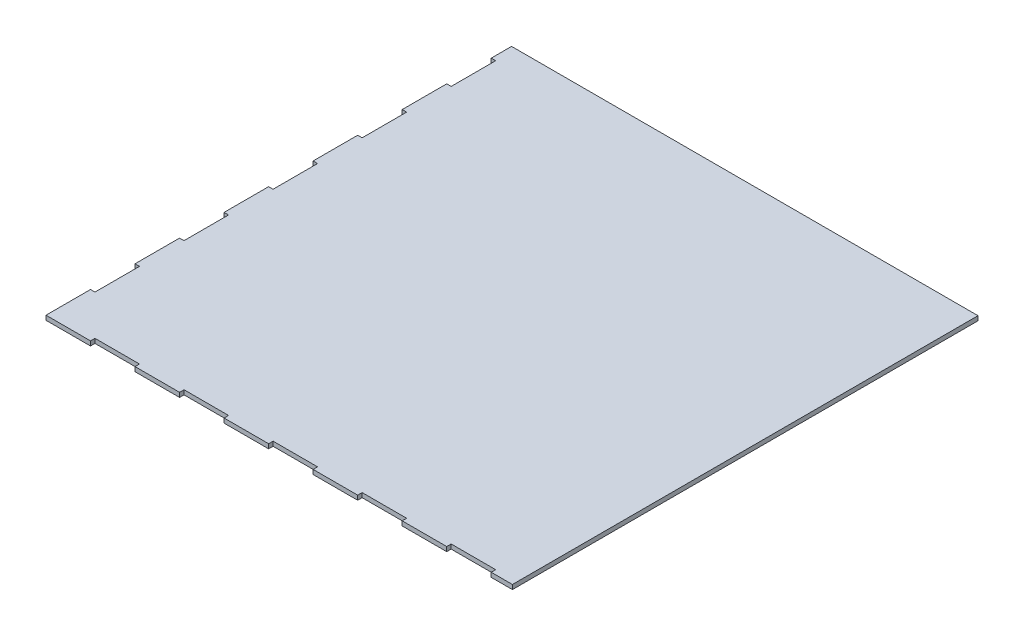
from build123d import *

# Parameters (mm, degrees)
SKETCH1_W               = 630
SKETCH1_H               = 630
BOSS_EXTRUDE1_DEPTH     = 3
SKETCH3_W               = 3
SKETCH3_H               = 30
CUT_EXTRUDE2_DEPTH      = 3
LPATTERN2_COUNT         = 10
LPATTERN2_PITCH         = 60
MIRROR1_COPY_1_SKETCH_W = 3
MIRROR1_COPY_1_SKETCH_H = 30
MIRROR1_COPY_1_DEPTH    = 3
MIRROR1_COPY_2_SKETCH_W = 3
MIRROR1_COPY_2_SKETCH_H = 30
MIRROR1_COPY_2_DEPTH    = 3
MIRROR1_COPY_3_SKETCH_W = 3
MIRROR1_COPY_3_SKETCH_H = 30
MIRROR1_COPY_3_DEPTH    = 3
MIRROR1_COPY_4_SKETCH_W = 3
MIRROR1_COPY_4_SKETCH_H = 30
MIRROR1_COPY_4_DEPTH    = 3
MIRROR1_COPY_5_SKETCH_W = 3
MIRROR1_COPY_5_SKETCH_H = 30
MIRROR1_COPY_5_DEPTH    = 3
MIRROR1_COPY_6_SKETCH_W = 3
MIRROR1_COPY_6_SKETCH_H = 30
MIRROR1_COPY_6_DEPTH    = 3
MIRROR1_COPY_7_SKETCH_W = 3
MIRROR1_COPY_7_SKETCH_H = 30
MIRROR1_COPY_7_DEPTH    = 3
MIRROR1_COPY_8_SKETCH_W = 3
MIRROR1_COPY_8_SKETCH_H = 30
MIRROR1_COPY_8_DEPTH    = 3
MIRROR1_COPY_9_SKETCH_W = 3
MIRROR1_COPY_9_SKETCH_H = 30
MIRROR1_COPY_9_DEPTH    = 3
SKETCH5_W               = 30
SKETCH5_H               = 3
CUT_EXTRUDE3_DEPTH      = 3
LPATTERN3_COUNT         = 10
LPATTERN3_PITCH         = 60
MIRROR2_COPY_1_SKETCH_W = 30
MIRROR2_COPY_1_SKETCH_H = 3
MIRROR2_COPY_1_DEPTH    = 3
MIRROR2_COPY_2_SKETCH_W = 30
MIRROR2_COPY_2_SKETCH_H = 3
MIRROR2_COPY_2_DEPTH    = 3
MIRROR2_COPY_3_SKETCH_W = 30
MIRROR2_COPY_3_SKETCH_H = 3
MIRROR2_COPY_3_DEPTH    = 3
MIRROR2_COPY_4_SKETCH_W = 30
MIRROR2_COPY_4_SKETCH_H = 3
MIRROR2_COPY_4_DEPTH    = 3
MIRROR2_COPY_5_SKETCH_W = 30
MIRROR2_COPY_5_SKETCH_H = 3
MIRROR2_COPY_5_DEPTH    = 3
MIRROR2_COPY_6_SKETCH_W = 30
MIRROR2_COPY_6_SKETCH_H = 3
MIRROR2_COPY_6_DEPTH    = 3
MIRROR2_COPY_7_SKETCH_W = 30
MIRROR2_COPY_7_SKETCH_H = 3
MIRROR2_COPY_7_DEPTH    = 3
MIRROR2_COPY_8_SKETCH_W = 30
MIRROR2_COPY_8_SKETCH_H = 3
MIRROR2_COPY_8_DEPTH    = 3
MIRROR2_COPY_9_SKETCH_W = 30
MIRROR2_COPY_9_SKETCH_H = 3
MIRROR2_COPY_9_DEPTH    = 3


with BuildPart() as part:
    # Sketch1 → Boss-Extrude1 (new body)
    with BuildSketch(Plane(origin=(0, 0, 0), x_dir=(1, 0, 0), z_dir=(0, 1, 0))):
        Rectangle(SKETCH1_W, SKETCH1_H)
    extrude(amount=BOSS_EXTRUDE1_DEPTH)

    # Sketch3 → Cut-Extrude2 (cut)
    with BuildSketch(Plane(origin=(0, 3, 0), x_dir=(1, 0, 0), z_dir=(0, 1, 0))):
        with Locations((-313.5, -270.006843512)):
            Rectangle(SKETCH3_W, SKETCH3_H)
    cut_extrude2 = extrude(amount=-CUT_EXTRUDE2_DEPTH, mode=Mode.SUBTRACT)

    # LPattern2: Cut-Extrude2 ×10
    with Locations(*[(0, 0, -i * LPATTERN2_PITCH) for i in range(1, LPATTERN2_COUNT)]):
        add(cut_extrude2, mode=Mode.SUBTRACT)

    # Mirror1: Cut-Extrude2 across plane
    add(cut_extrude2.mirror(Plane(origin=(-0.725, 0, 0), x_dir=(0, 0, 1), z_dir=(1, 0, 0))), mode=Mode.SUBTRACT)

    # Mirror1 copy 1 sketch → Mirror1 copy 1 (cut)
    with BuildSketch(Plane(origin=(-1.45, 3, -60), x_dir=(-1, 0, 0), z_dir=(0, 1, 0))):
        with Locations((-313.5, 270.006843512)):
            Rectangle(MIRROR1_COPY_1_SKETCH_W, MIRROR1_COPY_1_SKETCH_H)
    extrude(amount=-MIRROR1_COPY_1_DEPTH, mode=Mode.SUBTRACT)

    # Mirror1 copy 2 sketch → Mirror1 copy 2 (cut)
    with BuildSketch(Plane(origin=(-1.45, 3, -120), x_dir=(-1, 0, 0), z_dir=(0, 1, 0))):
        with Locations((-313.5, 270.006843512)):
            Rectangle(MIRROR1_COPY_2_SKETCH_W, MIRROR1_COPY_2_SKETCH_H)
    extrude(amount=-MIRROR1_COPY_2_DEPTH, mode=Mode.SUBTRACT)

    # Mirror1 copy 3 sketch → Mirror1 copy 3 (cut)
    with BuildSketch(Plane(origin=(-1.45, 3, -180), x_dir=(-1, 0, 0), z_dir=(0, 1, 0))):
        with Locations((-313.5, 270.006843512)):
            Rectangle(MIRROR1_COPY_3_SKETCH_W, MIRROR1_COPY_3_SKETCH_H)
    extrude(amount=-MIRROR1_COPY_3_DEPTH, mode=Mode.SUBTRACT)

    # Mirror1 copy 4 sketch → Mirror1 copy 4 (cut)
    with BuildSketch(Plane(origin=(-1.45, 3, -240), x_dir=(-1, 0, 0), z_dir=(0, 1, 0))):
        with Locations((-313.5, 270.006843512)):
            Rectangle(MIRROR1_COPY_4_SKETCH_W, MIRROR1_COPY_4_SKETCH_H)
    extrude(amount=-MIRROR1_COPY_4_DEPTH, mode=Mode.SUBTRACT)

    # Mirror1 copy 5 sketch → Mirror1 copy 5 (cut)
    with BuildSketch(Plane(origin=(-1.45, 3, -300), x_dir=(-1, 0, 0), z_dir=(0, 1, 0))):
        with Locations((-313.5, 270.006843512)):
            Rectangle(MIRROR1_COPY_5_SKETCH_W, MIRROR1_COPY_5_SKETCH_H)
    extrude(amount=-MIRROR1_COPY_5_DEPTH, mode=Mode.SUBTRACT)

    # Mirror1 copy 6 sketch → Mirror1 copy 6 (cut)
    with BuildSketch(Plane(origin=(-1.45, 3, -360), x_dir=(-1, 0, 0), z_dir=(0, 1, 0))):
        with Locations((-313.5, 270.006843512)):
            Rectangle(MIRROR1_COPY_6_SKETCH_W, MIRROR1_COPY_6_SKETCH_H)
    extrude(amount=-MIRROR1_COPY_6_DEPTH, mode=Mode.SUBTRACT)

    # Mirror1 copy 7 sketch → Mirror1 copy 7 (cut)
    with BuildSketch(Plane(origin=(-1.45, 3, -420), x_dir=(-1, 0, 0), z_dir=(0, 1, 0))):
        with Locations((-313.5, 270.006843512)):
            Rectangle(MIRROR1_COPY_7_SKETCH_W, MIRROR1_COPY_7_SKETCH_H)
    extrude(amount=-MIRROR1_COPY_7_DEPTH, mode=Mode.SUBTRACT)

    # Mirror1 copy 8 sketch → Mirror1 copy 8 (cut)
    with BuildSketch(Plane(origin=(-1.45, 3, -480), x_dir=(-1, 0, 0), z_dir=(0, 1, 0))):
        with Locations((-313.5, 270.006843512)):
            Rectangle(MIRROR1_COPY_8_SKETCH_W, MIRROR1_COPY_8_SKETCH_H)
    extrude(amount=-MIRROR1_COPY_8_DEPTH, mode=Mode.SUBTRACT)

    # Mirror1 copy 9 sketch → Mirror1 copy 9 (cut)
    with BuildSketch(Plane(origin=(-1.45, 3, -540), x_dir=(-1, 0, 0), z_dir=(0, 1, 0))):
        with Locations((-313.5, 270.006843512)):
            Rectangle(MIRROR1_COPY_9_SKETCH_W, MIRROR1_COPY_9_SKETCH_H)
    extrude(amount=-MIRROR1_COPY_9_DEPTH, mode=Mode.SUBTRACT)

    # Sketch5 → Cut-Extrude3 (cut)
    with BuildSketch(Plane(origin=(0, 3, 0), x_dir=(1, 0, 0), z_dir=(0, 1, 0))):
        with Locations((-270.000314512, -313.5)):
            Rectangle(SKETCH5_W, SKETCH5_H)
    cut_extrude3 = extrude(amount=-CUT_EXTRUDE3_DEPTH, mode=Mode.SUBTRACT)

    # LPattern3: Cut-Extrude3 ×10
    with Locations(*[(i * LPATTERN3_PITCH, 0, 0) for i in range(1, LPATTERN3_COUNT)]):
        add(cut_extrude3, mode=Mode.SUBTRACT)

    # Mirror2: Cut-Extrude3 across plane
    add(cut_extrude3.mirror(Plane.XY.offset(1.295)), mode=Mode.SUBTRACT)

    # Mirror2 copy 1 sketch → Mirror2 copy 1 (cut)
    with BuildSketch(Plane(origin=(60, 3, 2.59), x_dir=(1, 0, 0), z_dir=(0, 1, 0))):
        with Locations((-270.000314512, 313.5)):
            Rectangle(MIRROR2_COPY_1_SKETCH_W, MIRROR2_COPY_1_SKETCH_H)
    extrude(amount=-MIRROR2_COPY_1_DEPTH, mode=Mode.SUBTRACT)

    # Mirror2 copy 2 sketch → Mirror2 copy 2 (cut)
    with BuildSketch(Plane(origin=(120, 3, 2.59), x_dir=(1, 0, 0), z_dir=(0, 1, 0))):
        with Locations((-270.000314512, 313.5)):
            Rectangle(MIRROR2_COPY_2_SKETCH_W, MIRROR2_COPY_2_SKETCH_H)
    extrude(amount=-MIRROR2_COPY_2_DEPTH, mode=Mode.SUBTRACT)

    # Mirror2 copy 3 sketch → Mirror2 copy 3 (cut)
    with BuildSketch(Plane(origin=(180, 3, 2.59), x_dir=(1, 0, 0), z_dir=(0, 1, 0))):
        with Locations((-270.000314512, 313.5)):
            Rectangle(MIRROR2_COPY_3_SKETCH_W, MIRROR2_COPY_3_SKETCH_H)
    extrude(amount=-MIRROR2_COPY_3_DEPTH, mode=Mode.SUBTRACT)

    # Mirror2 copy 4 sketch → Mirror2 copy 4 (cut)
    with BuildSketch(Plane(origin=(240, 3, 2.59), x_dir=(1, 0, 0), z_dir=(0, 1, 0))):
        with Locations((-270.000314512, 313.5)):
            Rectangle(MIRROR2_COPY_4_SKETCH_W, MIRROR2_COPY_4_SKETCH_H)
    extrude(amount=-MIRROR2_COPY_4_DEPTH, mode=Mode.SUBTRACT)

    # Mirror2 copy 5 sketch → Mirror2 copy 5 (cut)
    with BuildSketch(Plane(origin=(300, 3, 2.59), x_dir=(1, 0, 0), z_dir=(0, 1, 0))):
        with Locations((-270.000314512, 313.5)):
            Rectangle(MIRROR2_COPY_5_SKETCH_W, MIRROR2_COPY_5_SKETCH_H)
    extrude(amount=-MIRROR2_COPY_5_DEPTH, mode=Mode.SUBTRACT)

    # Mirror2 copy 6 sketch → Mirror2 copy 6 (cut)
    with BuildSketch(Plane(origin=(360, 3, 2.59), x_dir=(1, 0, 0), z_dir=(0, 1, 0))):
        with Locations((-270.000314512, 313.5)):
            Rectangle(MIRROR2_COPY_6_SKETCH_W, MIRROR2_COPY_6_SKETCH_H)
    extrude(amount=-MIRROR2_COPY_6_DEPTH, mode=Mode.SUBTRACT)

    # Mirror2 copy 7 sketch → Mirror2 copy 7 (cut)
    with BuildSketch(Plane(origin=(420, 3, 2.59), x_dir=(1, 0, 0), z_dir=(0, 1, 0))):
        with Locations((-270.000314512, 313.5)):
            Rectangle(MIRROR2_COPY_7_SKETCH_W, MIRROR2_COPY_7_SKETCH_H)
    extrude(amount=-MIRROR2_COPY_7_DEPTH, mode=Mode.SUBTRACT)

    # Mirror2 copy 8 sketch → Mirror2 copy 8 (cut)
    with BuildSketch(Plane(origin=(480, 3, 2.59), x_dir=(1, 0, 0), z_dir=(0, 1, 0))):
        with Locations((-270.000314512, 313.5)):
            Rectangle(MIRROR2_COPY_8_SKETCH_W, MIRROR2_COPY_8_SKETCH_H)
    extrude(amount=-MIRROR2_COPY_8_DEPTH, mode=Mode.SUBTRACT)

    # Mirror2 copy 9 sketch → Mirror2 copy 9 (cut)
    with BuildSketch(Plane(origin=(540, 3, 2.59), x_dir=(1, 0, 0), z_dir=(0, 1, 0))):
        with Locations((-270.000314512, 313.5)):
            Rectangle(MIRROR2_COPY_9_SKETCH_W, MIRROR2_COPY_9_SKETCH_H)
    extrude(amount=-MIRROR2_COPY_9_DEPTH, mode=Mode.SUBTRACT)

    # SurfaceCut1
    split(bisect_by=Plane.XY.offset(1.295), keep=Keep.TOP)

    # SurfaceCut2
    split(bisect_by=Plane(origin=(-0.725, 0, 0), x_dir=(0, 0, -1), z_dir=(1, 0, 0)), keep=Keep.BOTTOM)


solid = part.part
